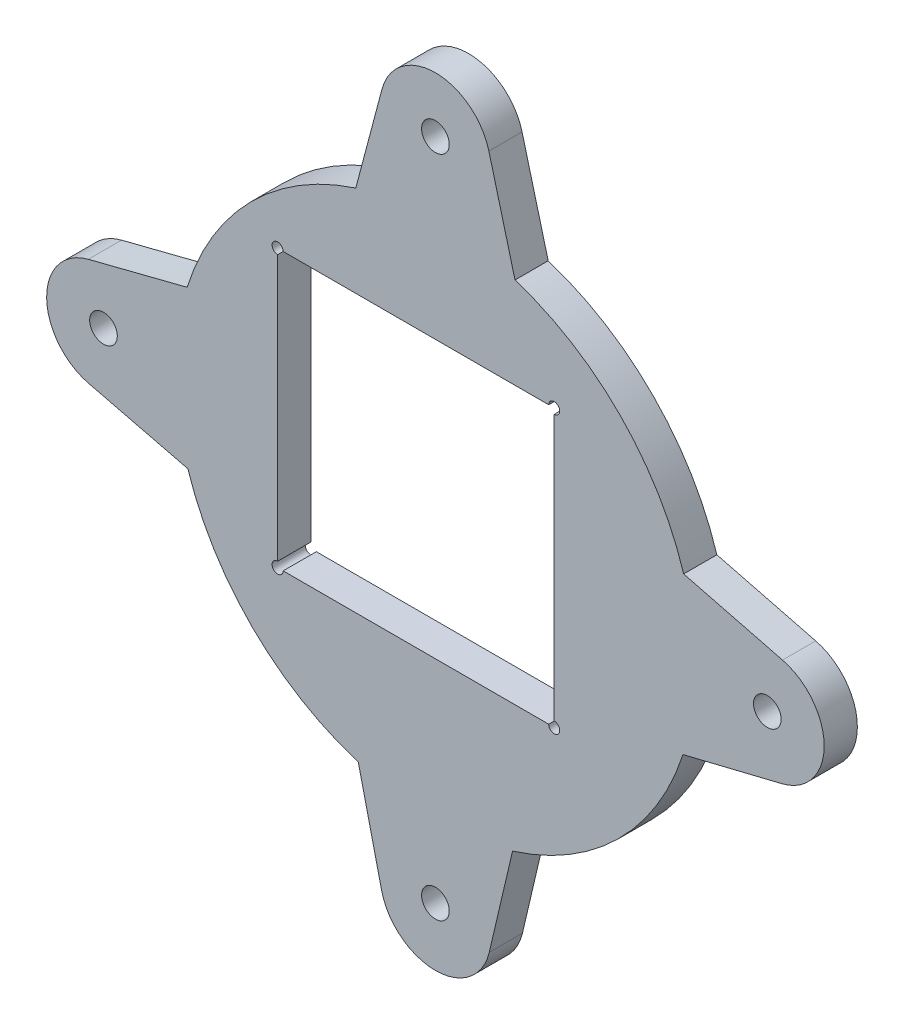
from build123d import *

# Parameters (mm, degrees)
SKETCH1_R           = 1.25
SKETCH1_W           = 25
SKETCH1_H           = 25
BOSS_EXTRUDE1_DEPTH = 3
SKETCH2_R           = 0.5
CUT_EXTRUDE1_DEPTH  = 10


with BuildPart() as part:
    # Sketch1 → Boss-Extrude1 (new body)
    with BuildSketch(Plane.XY):
        with BuildLine():
            Line((-33.221634358, 0.474846268), (-24.289446699, 2.749498978))
            ThreePointArc((-24.289446699, 2.749498978), (-18.546247277, 12.304618098), (-9.045759802, 18.137745796))
            Line((-9.045759802, 18.137745796), (-6.684093846, 27.047322398))
            ThreePointArc((-6.684093846, 27.047322398), (-1.851003919, 30.766212818), (2.982086008, 27.047322398))
            Line((2.982086008, 27.047322398), (5.343751964, 18.137745796))
            ThreePointArc((5.343751964, 18.137745796), (14.844239439, 12.304618098), (20.587438861, 2.749498978))
            Line((20.587438861, 2.749498978), (29.51962652, 0.474846268))
            ThreePointArc((29.51962652, 0.474846268), (33.2856667, -4.393192656), (29.475612525, -9.226860909))
            Line((29.475612525, -9.226860909), (20.523154011, -11.420375867))
            ThreePointArc((20.523154011, -11.420375867), (14.686585816, -20.929838384), (5.121898214, -26.675459041))
            Line((5.121898214, -26.675459041), (3.016856108, -35.649132707))
            ThreePointArc((3.016856108, -35.649132707), (-1.851003919, -39.507231329), (-6.718863946, -35.649132707))
            Line((-6.718863946, -35.649132707), (-8.823906053, -26.675459041))
            ThreePointArc((-8.823906053, -26.675459041), (-18.388593654, -20.929838384), (-24.225161849, -11.420375867))
            Line((-24.225161849, -11.420375867), (-33.177620364, -9.226860909))
            ThreePointArc((-33.177620364, -9.226860909), (-36.987674539, -4.393192656), (-33.221634358, 0.474846268))
        make_face()
        with Locations((-1.851003919, 25.766212818)):
            Circle(SKETCH1_R, mode=Mode.SUBTRACT)
        with Locations((28.148996081, -4.233787182)):
            Circle(SKETCH1_R, mode=Mode.SUBTRACT)
        with Locations((-1.851003919, -34.233787182)):
            Circle(SKETCH1_R, mode=Mode.SUBTRACT)
        with Locations((-31.851003919, -4.233787182)):
            Circle(SKETCH1_R, mode=Mode.SUBTRACT)
        with Locations((-3.613074624, -2.60843855)):
            Rectangle(SKETCH1_W, SKETCH1_H, mode=Mode.SUBTRACT)
    extrude(amount=BOSS_EXTRUDE1_DEPTH)

    # Sketch2 → Cut-Extrude1 (cut)
    with BuildSketch(Plane.XY.offset(3)):
        with Locations((-16.113074624, 9.89156145)):
            Circle(SKETCH2_R)
        with Locations((8.886925376, 9.89156145)):
            Circle(SKETCH2_R)
        with Locations((8.886925376, -15.10843855)):
            Circle(SKETCH2_R)
        with Locations((-16.113074624, -15.10843855)):
            Circle(SKETCH2_R)
    extrude(amount=-CUT_EXTRUDE1_DEPTH, mode=Mode.SUBTRACT)


solid = part.part
